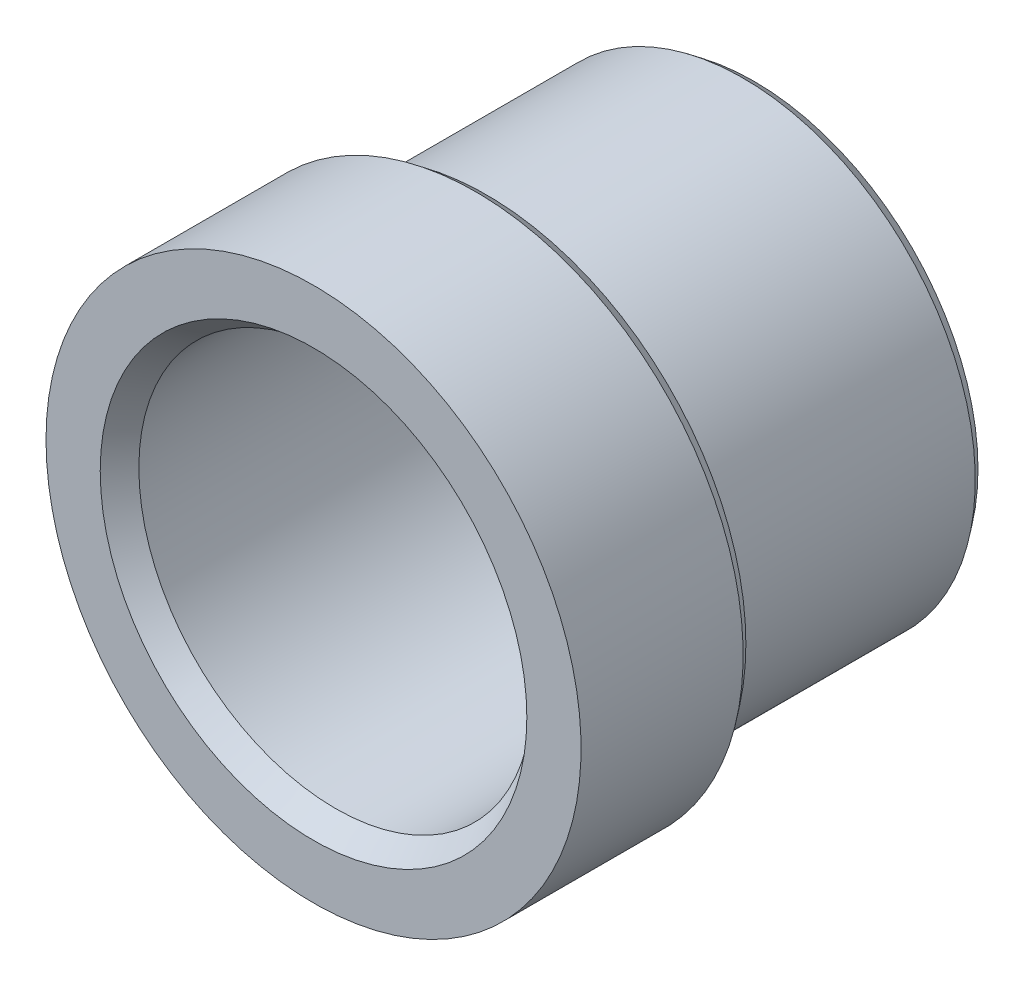
from build123d import *
from OCP.BRepFilletAPI import BRepFilletAPI_MakeChamfer

# Parameters (mm, degrees)
CHAMFER1_SIZE  = 0.7112
CHAMFER1_SIZE2 = 0.53592764
CHAMFER2_SIZE  = 0.3556
CHAMFER2_SIZE2 = 0.26796382


with BuildPart() as part:
    # Sketch2 → Revolve1 (revolve)
    with BuildSketch(Plane(origin=(0, 0, 0), x_dir=(0, 0, -1), z_dir=(1, 0, 0)), mode=Mode.PRIVATE) as revolve1_sk:
        Polygon((7.112, 6.35), (7.112, 7.493), (-1.524, 7.493), (-1.524, 8.636), (-7.112, 8.636), (-7.112, 6.35), align=None)
    revolve(revolve1_sk.sketch.rotate(Axis((0, 0, -7.112), (0, 0, 1)), 90), axis=Axis((0, 0, -7.112), (0, 0, 1)))

    # Chamfer1
    chamfer1_edges = [part.edges().sort_by_distance(p)[0] for p in [
        (6.35, 0, 7.112),
    ]]
    chamfer1_side = [part.faces().sort_by_distance(p)[0] for p in [
        (6.35, 0, 0),
    ]]
    chamfer(chamfer1_edges, length=CHAMFER1_SIZE, length2=CHAMFER1_SIZE2, reference=chamfer1_side[0])

    # Chamfer2: one chamfer whose edges measure the first distance from different faces: ONE call of the kernel's chamfer builder (chamfer() names one face for all edges)
    chamfer2_edges_1 = [part.edges().sort_by_distance(p)[0] for p in [
        (8.636, 0, 1.524),
    ]]
    chamfer2_side_1 = [part.faces().sort_by_distance(p)[0] for p in [
        (8.636, 0, 4.318),
    ]]
    chamfer2_edges_2 = [part.edges().sort_by_distance(p)[0] for p in [
        (7.493, 0, -7.112),
    ]]
    chamfer2_side_2 = [part.faces().sort_by_distance(p)[0] for p in [
        (7.493, 0, -2.794),
    ]]
    chamfer2 = BRepFilletAPI_MakeChamfer(part.part.solid().wrapped)
    for e in chamfer2_edges_1:
        chamfer2.Add(CHAMFER2_SIZE, CHAMFER2_SIZE2, e.wrapped, chamfer2_side_1[0].wrapped)  # the first distance lies on this face
    for e in chamfer2_edges_2:
        chamfer2.Add(CHAMFER2_SIZE, CHAMFER2_SIZE2, e.wrapped, chamfer2_side_2[0].wrapped)  # the first distance lies on this face
    add(Compound.cast(chamfer2.Shape()), mode=Mode.REPLACE)


solid = part.part
